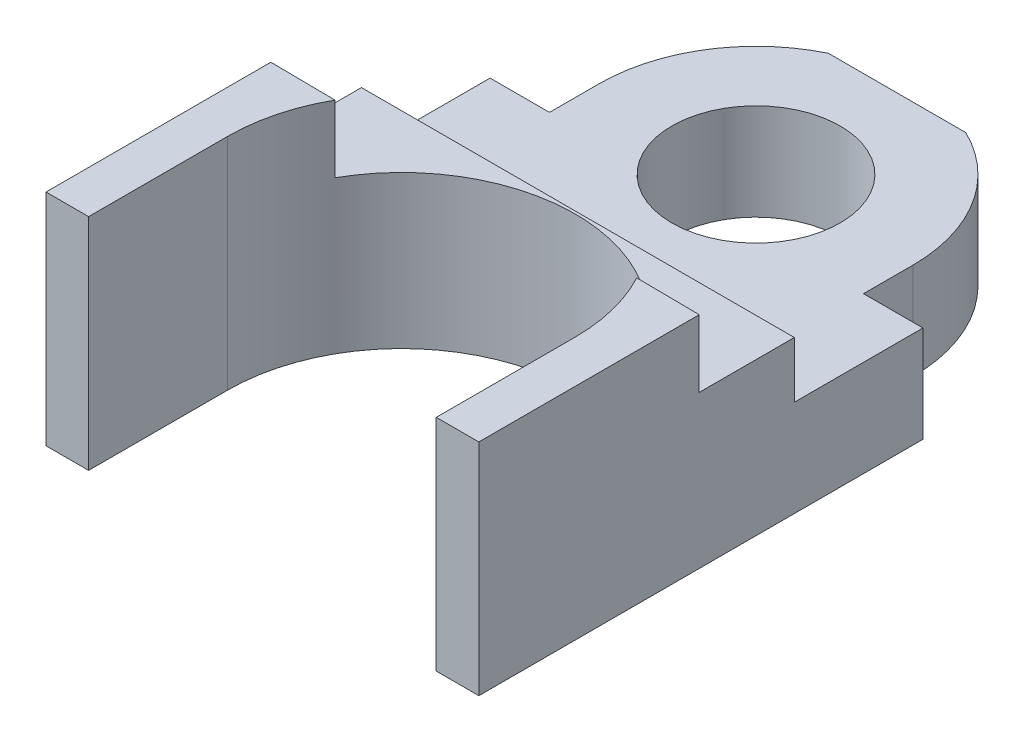
from build123d import *

# Parameters (mm, degrees)
EXTRUDE_2_DEPTH     = 9.8
CUT_EXTRUDE_1_DEPTH = 3
CUT_EXTRUDE_2_DEPTH = 2.5


with BuildPart() as part:
    # 草图1 → 凸台-拉伸2 (new body)
    with BuildSketch(Plane(origin=(0, 0, 0), x_dir=(1, 0, 0), z_dir=(0, 1, 0))):
        with BuildLine():
            Line((4.583240997, 11.690443213), (4.583240997, 14.234072022))
            Line((4.583240997, 14.234072022), (1.518891733, 14.234072022))
            ThreePointArc((1.518891733, 14.234072022), (-1.351843031, 11.65188196), (-2.416759003, 7.940443213))
            Line((-2.416759003, 7.940443213), (-2.416759003, 5.734072022))
            Line((-2.416759003, 5.734072022), (-5.066759003, 5.734072022))
            Line((-5.066759003, 5.734072022), (-5.066759003, -14.065927978))
            Line((-5.066759003, -14.065927978), (-3.166759003, -14.065927978))
            Line((-3.166759003, -14.065927978), (-3.166759003, -7.864819945))
            ThreePointArc((-3.166759003, -7.864819945), (-0.896836557, -2.38474239), (4.583240997, -0.114819945))
            Line((4.583240997, -0.114819945), (4.583240997, 4.190443213))
            ThreePointArc((4.583240997, 4.190443213), (0.833240997, 7.940443213), (4.583240997, 11.690443213))
        make_face()
        with BuildLine():
            ThreePointArc((11.583240997, 7.940443213), (10.518325026, 11.65188196), (7.647590262, 14.234072022))
            Line((7.647590262, 14.234072022), (4.583240997, 14.234072022))
            Line((4.583240997, 14.234072022), (4.583240997, 11.690443213))
            ThreePointArc((4.583240997, 11.690443213), (7.234891427, 10.592093643), (8.333240997, 7.940443213))
            ThreePointArc((8.333240997, 7.940443213), (7.234891427, 5.288792784), (4.583240997, 4.190443213))
            Line((4.583240997, 4.190443213), (4.583240997, -0.114819945))
            ThreePointArc((4.583240997, -0.114819945), (10.063318551, -2.38474239), (12.333240997, -7.864819945))
            Line((12.333240997, -7.864819945), (12.333240997, -14.065927978))
            Line((12.333240997, -14.065927978), (14.233240997, -14.065927978))
            Line((14.233240997, -14.065927978), (14.233240997, 5.734072022))
            Line((14.233240997, 5.734072022), (11.583240997, 5.734072022))
            Line((11.583240997, 5.734072022), (11.583240997, 7.940443213))
        make_face()
    extrude(amount=EXTRUDE_2_DEPTH)

    # 草图2 → 切除-拉伸1 (cut)
    with BuildSketch(Plane(origin=(0, 9.8, 0), x_dir=(1, 0, 0), z_dir=(0, 1, 0))):
        Polygon((-7.578838201, -4.016286107), (16.085093039, -4.259527691), (16.085093039, 14.991306239), (-7.578838201, 14.991306239), align=None)
    extrude(amount=-CUT_EXTRUDE_1_DEPTH, mode=Mode.SUBTRACT)

    # 草图3 → 切除-拉伸2 (cut)
    with BuildSketch(Plane(origin=(0, 6.8, 0), x_dir=(1, 0, 0), z_dir=(0, 1, 0))):
        Polygon((-9.750638057, 0), (19.90166932, 0), (19.90166932, 15.470839647), (-9.750638057, 15.762729548), align=None)
    extrude(amount=-CUT_EXTRUDE_2_DEPTH, mode=Mode.SUBTRACT)


solid = part.part
